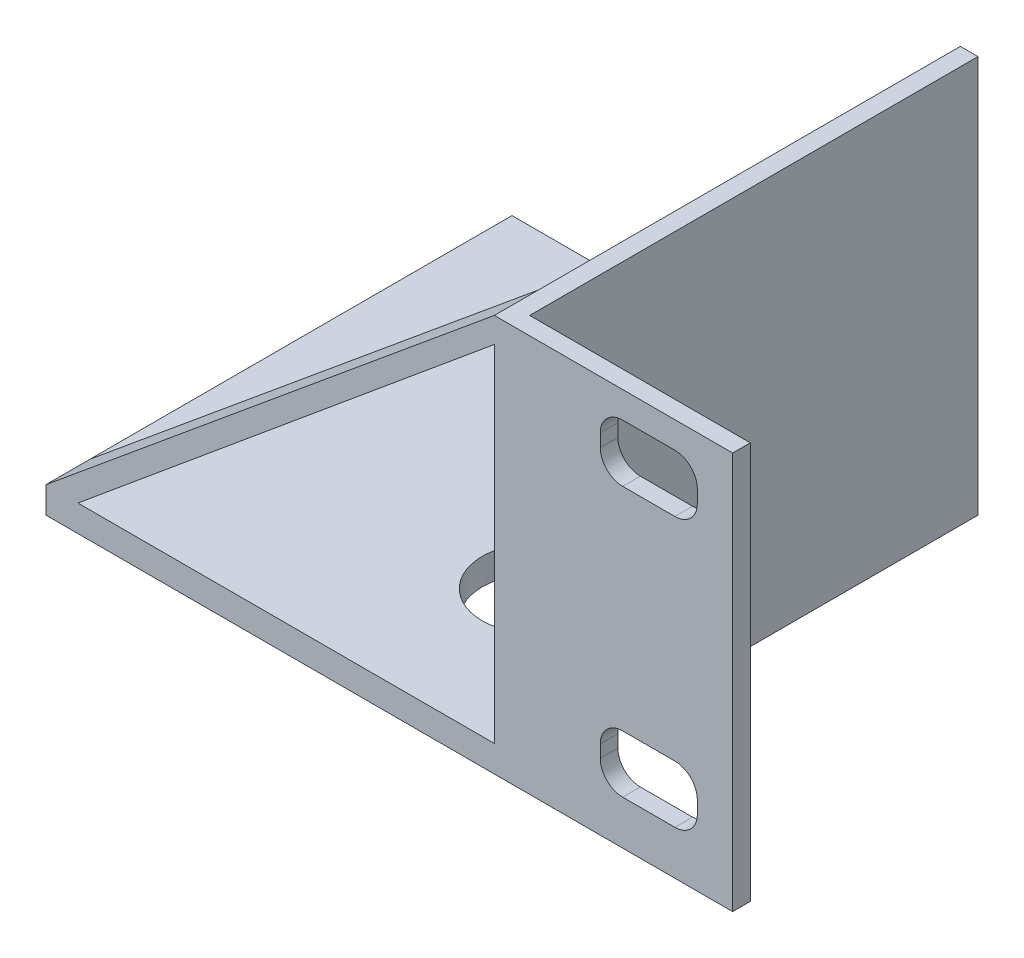
from build123d import *

# Parameters (mm, degrees)
SKETCH1_W           = 25
SKETCH1_H           = 45
BOSS_EXTRUDE1_DEPTH = 2
SKETCH2_W           = 11
SKETCH2_H           = 6.5
CUT_EXTRUDE1_DEPTH  = 19.78
FILLET1_R           = 2.54
BOSS_EXTRUDE2_DEPTH = 2
SKETCH4_W           = 52.8
SKETCH4_H           = 3
BOSS_EXTRUDE3_DEPTH = 50.8
BOSS_EXTRUDE4_DEPTH = 5
SKETCH7_R           = 6.35
CUT_EXTRUDE3_DEPTH  = 5


with BuildPart() as part:
    # Sketch1 → Boss-Extrude1 (new body)
    with BuildSketch(Plane.XY):
        with Locations((-12.5, 22.5)):
            Rectangle(SKETCH1_W, SKETCH1_H)
    extrude(amount=BOSS_EXTRUDE1_DEPTH)

    # Sketch2 → Cut-Extrude1 (cut)
    with BuildSketch(Plane.XY.offset(2)):
        with Locations((-9.5, 8.25)):
            Rectangle(SKETCH2_W, SKETCH2_H)
        with Locations((-9.5, 38.75)):
            Rectangle(SKETCH2_W, SKETCH2_H)
    extrude(amount=-CUT_EXTRUDE1_DEPTH, mode=Mode.SUBTRACT)

    # Fillet1
    fillet1_edges = [part.edges().sort_by_distance(p)[0] for p in [
        (-15, 11.5, 1),
        (-4, 11.5, 1),
        (-4, 5, 1),
        (-15, 5, 1),
        (-15, 42, 1),
        (-4, 42, 1),
        (-4, 35.5, 1),
        (-15, 35.5, 1),
    ]]
    fillet(fillet1_edges, radius=FILLET1_R)

    # Sketch3 → Boss-Extrude2 (add)
    with BuildSketch(Plane.ZY.offset(25)):
        Polygon((2, 0), (0, 0), (-50.8, 0), (-50.8, 45), (0, 45), (2, 45), align=None)
    extrude(amount=BOSS_EXTRUDE2_DEPTH)

    # Sketch4 → Boss-Extrude3 (add)
    with BuildSketch(Plane.ZY.offset(27)):
        with Locations((-24.4, 1.5)):
            Rectangle(SKETCH4_W, SKETCH4_H)
    extrude(amount=BOSS_EXTRUDE3_DEPTH)

    # Sketch5 → Boss-Extrude4 (add)
    with BuildSketch(Plane.XY.offset(2)):
        Polygon((-77.8, 3), (-27, 45), (-27, 42.151802073), (-77.8, 0), align=None)
    extrude(amount=-BOSS_EXTRUDE4_DEPTH)

    # Sketch7 → Cut-Extrude3 (cut)
    with BuildSketch(Plane(origin=(0, 3, 0), x_dir=(1, 0, 0), z_dir=(0, 1, 0))):
        with Locations(Location((-39.7, 15.7, 0), (0, 0, 270))):
            Circle(SKETCH7_R)
    extrude(amount=-CUT_EXTRUDE3_DEPTH, mode=Mode.SUBTRACT)


solid = part.part
